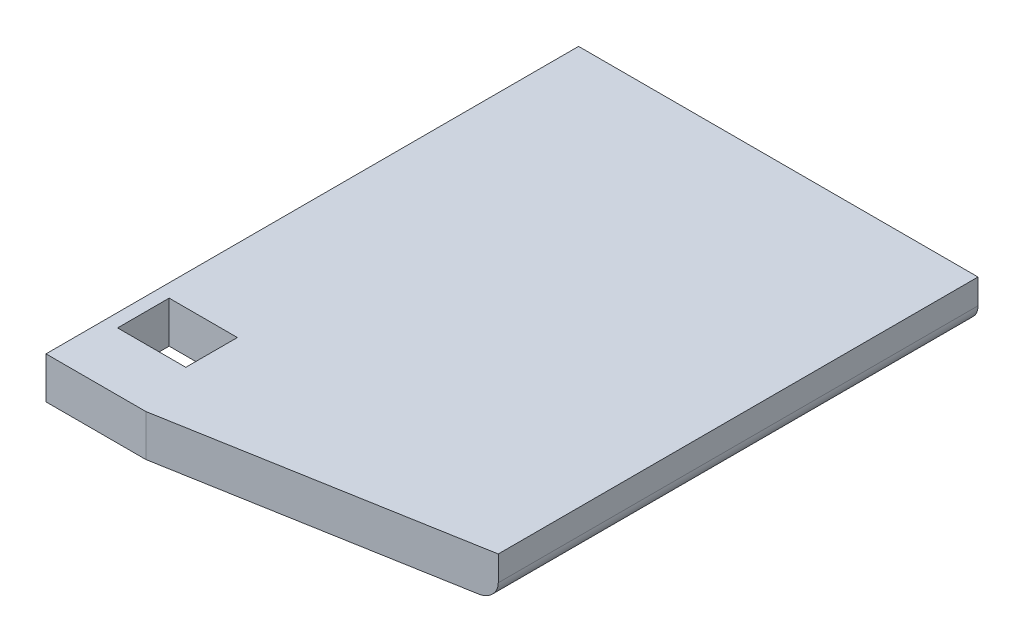
from build123d import *

# Parameters (mm, degrees)
SKETCH_3_W          = 2.5
SKETCH_3_H          = 24
EXTRUDE_1_DEPTH     = 33
FILLET_1_R          = 1
CUT_EXTRUDE_3_DEPTH = 41.880924647
SKETCH_6_W          = 2.5
SKETCH_6_H          = 3.1
CUT_EXTRUDE_4_DEPTH = 4.9
SKETCH_7_W          = 24
SKETCH_7_H          = 2.5
CUT_EXTRUDE_5_DEPTH = 1
CUT_EXTRUDE_6_DEPTH = 41.078048855
CUT_EXTRUDE_7_DEPTH = 1
SKETCH_1927_W       = 0.8
SKETCH_1927_H       = 3.1
EXTRUDE_2_DEPTH     = 2.5


with BuildPart() as part:
    # 草图3 → 凸台-拉伸1 (new body)
    with BuildSketch(Plane(origin=(0, 0, 0), x_dir=(0, 1, 0), z_dir=(0, 0, 1))):
        with Locations((1.25, -12)):
            Rectangle(SKETCH_3_W, SKETCH_3_H)
    extrude(amount=EXTRUDE_1_DEPTH)

    # 圆角1
    fillet_1_edges = [part.edges().sort_by_distance(p)[0] for p in [
        (24, 0, 16.5),
    ]]
    fillet(fillet_1_edges, radius=FILLET_1_R)

    # 草图5 → 切除-拉伸3 (cut, through all)
    with BuildSketch(Plane(origin=(0, 2.5, 0), x_dir=(-1, 0, 0), z_dir=(0, 1, 0))):
        Polygon((-3, 33), (-24, 31.162738066), (-24, 33), align=None)
    extrude(amount=-CUT_EXTRUDE_3_DEPTH, mode=Mode.SUBTRACT)

    # 草图6 → 切除-拉伸4 (cut)
    with BuildSketch(Plane(origin=(0, 0, 0), x_dir=(0, -1, 0), z_dir=(-1, 0, 0))):
        with Locations((-1.25, 26.95)):
            Rectangle(SKETCH_6_W, SKETCH_6_H)
    extrude(amount=-CUT_EXTRUDE_4_DEPTH, mode=Mode.SUBTRACT)

    # 草图7 → 切除-拉伸5 (cut)
    with BuildSketch(Plane.XY.offset(33)):
        with Locations((12, 1.25)):
            Rectangle(SKETCH_7_W, SKETCH_7_H)
    extrude(amount=-CUT_EXTRUDE_5_DEPTH, mode=Mode.SUBTRACT)

    # 草图8 → 切除-拉伸6 (cut, through all)
    with BuildSketch(Plane(origin=(0, 2.5, 0), x_dir=(-1, 0, 0), z_dir=(0, 1, 0))):
        Polygon((-24, 31.162738066), (-24, 28.826114347), (-6, 32), (-14.430052303, 32), align=None)
    extrude(amount=-CUT_EXTRUDE_6_DEPTH, mode=Mode.SUBTRACT)

    # 草图9 → 切除-拉伸7 (cut)
    # profile 1 of 3: a face of its own
    with BuildSketch(Plane.XZ):
        with BuildLine():
            Line((6.826102893, 17.534509717), (7.055889808, 17.586094534))
            Line((7.055889808, 17.586094534), (7.790582664, 16.932686845))
            add(Edge.make_bspline(
                [(7.790582664, 16.932686845), (7.752972061, 16.901011077), (7.686266602, 16.844831529), (7.607093174, 16.776013844), (7.549557385, 16.72407627), (7.505058445, 16.677259698), (7.455177068, 16.620812568), (7.399923749, 16.555326591), (7.342586576, 16.477687324), (7.292080703, 16.382309348), (7.243025403, 16.272950106), (7.216673958, 16.193069549), (7.202828379, 16.1510987)],
                knots=[0, 0, 0, 0, 1.480711259, 2.62616163, 3.15919736, 3.813913131, 4.569696636, 5.427556549, 6.394311754, 7.468779871, 8.670046126, 10, 10, 10, 10], degree=3))
            Line((7.202828379, 16.1510987), (4.998749811, 10.528353586))
            Line((4.998749811, 10.528353586), (4.622024325, 10.517411352))
            Line((4.622024325, 10.517411352), (2.355418705, 16.373069734))
            add(Edge.make_bspline(
                [(2.355418705, 16.373069734), (2.343595726, 16.398160222), (2.317764578, 16.452978568), (2.27196974, 16.540326468), (2.217301146, 16.640414177), (2.155439715, 16.74777141), (2.094310938, 16.855419824), (2.035480198, 16.951053619), (1.98337912, 17.031861495), (1.925224333, 17.11697445), (1.856052924, 17.204012375), (1.795837856, 17.26303752), (1.76766442, 17.290654216)],
                knots=[0, 0, 0, 0, 0.760048084, 1.660572675, 2.702204908, 3.885350124, 5.056107857, 6.094505048, 6.961928109, 7.690750397, 8.919547878, 10, 10, 10, 10], degree=3))
            Line((1.76766442, 17.290654216), (1.620725848, 17.428213729))
            Line((1.620725848, 17.428213729), (1.76766442, 17.554831009))
            Line((1.76766442, 17.554831009), (2.879082762, 17.154657879))
            add(Edge.make_bspline(
                [(2.879082762, 17.154657879), (2.860942204, 17.115124822), (2.827439897, 17.042114467), (2.800294401, 16.926117748), (2.806671207, 16.803059087), (2.836173348, 16.665489098), (2.886974725, 16.509602015), (2.923814048, 16.399607802), (2.94317299, 16.341806208)],
                knots=[0, 0, 0, 0, 0.925705793, 1.709610016, 2.509235913, 3.528169894, 4.701061495, 6, 6, 6, 6], degree=3))
            Line((2.94317299, 16.341806208), (4.811168656, 11.561613114))
            Line((4.811168656, 11.561613114), (6.679164322, 16.373069734))
            add(Edge.make_bspline(
                [(6.679164322, 16.373069734), (6.699826512, 16.433777322), (6.744076006, 16.563786778), (6.785174251, 16.733224985), (6.817366513, 16.871571444), (6.838394784, 16.966283558), (6.853394219, 17.048326943), (6.862581052, 17.098904281), (6.866745477, 17.121831176)],
                knots=[0, 0, 0, 0, 1.493135601, 3.197652068, 4.057375543, 4.802536005, 5.457185135, 6, 6, 6, 6], degree=3))
            add(Edge.make_bspline(
                [(6.866745477, 17.121831176), (6.866172996, 17.163599447), (6.865052356, 17.245361478), (6.852543078, 17.326162831), (6.846424185, 17.365686678)],
                knots=[0, 0, 0, 0, 1.02170334, 2, 2, 2, 2], degree=3))
            Line((6.846424185, 17.365686678), (6.826102893, 17.534509717))
        make_face()
    # profile 2 of 3: a face of its own
    with BuildSketch(Plane.XZ):
        with BuildLine():
            Line((11.364003663, 17.407892437), (11.593790577, 17.407892437))
            Line((11.593790577, 17.407892437), (11.573469286, 11.803905438))
            add(Edge.make_bspline(
                [(11.573469286, 11.803905438), (11.57215625, 11.753352963), (11.56963783, 11.656392655), (11.562088287, 11.517884509), (11.558819088, 11.392199872), (11.551402242, 11.279753622), (11.547137952, 11.180191846), (11.543225715, 11.093592319), (11.53592772, 11.020277115), (11.528248468, 10.904591429), (11.50587219, 10.746228863), (11.471111352, 10.580856867), (11.433173118, 10.466767264), (11.399765074, 10.406001097), (11.350313093, 10.372115518), (11.316404835, 10.377320417), (11.299913435, 10.379851838)],
                knots=[0, 0, 0, 0, 1.394953029, 2.67553809, 3.826273234, 4.862803321, 5.783754953, 6.575504875, 7.253529159, 7.815774618, 9.773449153, 11.659962388, 12.469263007, 13.083324233, 13.554171552, 14, 14, 14, 14], degree=3))
            add(Edge.make_bspline(
                [(11.299913435, 10.379851838), (11.295752273, 10.381432556), (11.278024103, 10.38816703), (11.240968986, 10.399981584), (11.191147952, 10.43568526), (11.166695544, 10.474017809), (11.152974864, 10.495526884)],
                knots=[0, 0, 0, 0, 0.277821374, 1.183627148, 2.41968315, 4, 4, 4, 4], degree=3))
            Line((11.152974864, 10.495526884), (11.048242052, 10.633086397))
            Line((11.048242052, 10.633086397), (10.816891961, 11.012938236))
            add(Edge.make_bspline(
                [(10.816891961, 11.012938236), (10.789247266, 11.048470901), (10.741546866, 11.109781844), (10.687713479, 11.191637945), (10.654166637, 11.24288422), (10.644745807, 11.290357959), (10.687796711, 11.327113841), (10.726162645, 11.387479103), (10.779830154, 11.465076053), (10.828992478, 11.558332765), (10.878147962, 11.656543483), (10.915361738, 11.765135476), (10.942985639, 11.886508306), (10.952140591, 12.003319825), (10.95837894, 12.114916831), (10.960681773, 12.222319127), (10.964822685, 12.349427318), (10.964175917, 12.441155454), (10.963830533, 12.49013983)],
                knots=[0, 0, 0, 0, 1.348621873, 2.327021565, 2.927512079, 3.194695252, 3.6755439, 4.434148094, 5.403918541, 6.472765214, 7.596830534, 8.687787393, 9.903387405, 11.315204673, 12.190562497, 13.252434005, 14.532753282, 16, 16, 16, 16], degree=3))
            Line((10.963830533, 12.49013983), (10.985715001, 16.626304293))
            Line((10.985715001, 16.626304293), (9.89461795, 16.1510987))
            Line((9.89461795, 16.1510987), (9.810206431, 16.330863974))
            add(Edge.make_bspline(
                [(9.810206431, 16.330863974), (9.898046083, 16.376684994), (10.061188901, 16.461787452), (10.282374862, 16.587332688), (10.464901043, 16.693939868), (10.655299483, 16.819162593), (10.867791854, 16.975854409), (11.02849935, 17.107557446), (11.110769104, 17.17497917)],
                knots=[0, 0, 0, 0, 1.147110071, 2.130504433, 2.944870009, 3.594182876, 4.768408533, 6, 6, 6, 6], degree=3))
            Line((11.110769104, 17.17497917), (11.364003663, 17.407892437))
        make_face()
    # profile 3 of 3: a face of its own
    with BuildSketch(Plane.XZ):
        with BuildLine():
            add(Edge.make_bspline(
                [(15.554879296, 14.115843171), (15.564422235, 14.217105414), (15.584047735, 14.425355934), (15.641760216, 14.743418301), (15.724687292, 15.074647026), (15.807897909, 15.358193432), (15.888430624, 15.587171128), (15.963121664, 15.754596989), (16.045187705, 15.917703534), (16.139551959, 16.07386099), (16.24285665, 16.224215684), (16.355587945, 16.368801737), (16.479917756, 16.506649622), (16.612637459, 16.637451594), (16.748797926, 16.75876255), (16.881475213, 16.870855721), (17.011748915, 16.968696708), (17.135676211, 17.057157883), (17.257402755, 17.13082149), (17.374291339, 17.194052923), (17.48822997, 17.244399471), (17.633139291, 17.293153922), (17.807476438, 17.337143979), (18.009450884, 17.375343438), (18.202401522, 17.397217004), (18.327904687, 17.397037479), (18.388917909, 17.396950203)],
                knots=[0, 0, 0, 0, 1.529413248, 3.145309584, 4.856174907, 6.663919439, 7.588678728, 8.50466094, 9.419535901, 10.333571141, 11.246664977, 12.1623118, 13.089194382, 14.0369187, 14.963801283, 15.831851732, 16.648562731, 17.413941845, 18.12099543, 18.787207369, 19.411923779, 19.991920055, 21.085003429, 22.113427482, 23.08284489, 24, 24, 24, 24], degree=3))
            add(Edge.make_bspline(
                [(18.388917909, 17.396950203), (18.446928437, 17.391900877), (18.566996791, 17.381449941), (18.750411797, 17.341113173), (18.944650052, 17.287935187), (19.147949871, 17.219578465), (19.351474125, 17.127556062), (19.546729548, 17.00612579), (19.726248188, 16.852096511), (19.892839753, 16.674852261), (20.04489021, 16.48213183), (20.185161602, 16.284120235), (20.30643579, 16.07979521), (20.415815297, 15.872213943), (20.511092, 15.655861575), (20.589732286, 15.426987731), (20.65795371, 15.18557992), (20.726278727, 14.845990671), (20.789495866, 14.410913695), (20.798143478, 14.058783783), (20.802462101, 13.882929904)],
                knots=[0, 0, 0, 0, 0.666492795, 1.379485695, 2.147045133, 2.973923324, 3.834071854, 4.700351037, 5.598461949, 6.535907071, 7.483128048, 8.408906052, 9.313934277, 10.203092469, 11.095930338, 12.019144949, 12.97363678, 13.967633829, 15.986234022, 18, 18, 18, 18], degree=3))
            add(Edge.make_bspline(
                [(20.802462101, 13.882929904), (20.784072501, 13.741938273), (20.746087558, 13.450710667), (20.666439388, 13.085792449), (20.579282324, 12.784978305), (20.492730615, 12.552195109), (20.38436839, 12.317267356), (20.258203223, 12.080756781), (20.116337354, 11.847811058), (19.955948623, 11.624681404), (19.779188685, 11.413743091), (19.589097773, 11.217247401), (19.390413647, 11.040075586), (19.181498265, 10.895260052), (18.967355817, 10.782386042), (18.749221774, 10.703772974), (18.535520368, 10.650187686), (18.330041745, 10.615646033), (18.135504926, 10.596366358), (18.009096443, 10.600046932), (17.948102196, 10.601822872)],
                knots=[0, 0, 0, 0, 1.601116752, 3.307213304, 4.200501105, 5.127176602, 6.101561659, 7.112436591, 8.145206986, 9.171352057, 10.204622639, 11.242284475, 12.248805296, 13.197957822, 14.098389581, 14.967380699, 15.802967193, 16.576805292, 17.313284303, 18, 18, 18, 18], degree=3))
            add(Edge.make_bspline(
                [(17.948102196, 10.601822872), (17.890125672, 10.605874798), (17.770218621, 10.614254993), (17.585573345, 10.650596106), (17.390717798, 10.705680251), (17.186724086, 10.779664), (16.979577778, 10.878467734), (16.779163628, 11.011493952), (16.585613476, 11.174918393), (16.400018752, 11.365286798), (16.229161831, 11.579599839), (16.073554206, 11.808000525), (15.938171519, 12.050008953), (15.826072871, 12.303061133), (15.733423481, 12.55820433), (15.660180171, 12.808562275), (15.61153227, 13.052425451), (15.584103419, 13.287829108), (15.571907123, 13.512897669), (15.562571761, 13.725518702), (15.555495813, 13.92508861), (15.555079716, 14.0538317), (15.554879296, 14.115843171)],
                knots=[0, 0, 0, 0, 0.738063801, 1.526463623, 2.386101568, 3.310039566, 4.281526039, 5.295424417, 6.357861015, 7.495855073, 8.668693725, 9.836886415, 11.004985247, 12.187747215, 13.350445862, 14.452951707, 15.499752378, 16.506815042, 17.46230185, 18.363824765, 19.211906185, 20, 20, 20, 20], degree=3))
        make_face()
        with BuildLine():
            add(Edge.make_bspline(
                [(16.101990997, 14.093958703), (16.098784775, 14.043433035), (16.091980462, 13.936206379), (16.094074174, 13.765130676), (16.097712456, 13.57483338), (16.110370593, 13.368288247), (16.131486691, 13.150479694), (16.175119371, 12.929315087), (16.23287034, 12.706191262), (16.307430637, 12.483386208), (16.399598142, 12.265119667), (16.504161867, 12.052333507), (16.624997666, 11.849490072), (16.757312493, 11.657207639), (16.900424404, 11.483309741), (17.052000155, 11.33467386), (17.211226318, 11.215540814), (17.375855751, 11.126464922), (17.539858983, 11.06372941), (17.696762644, 11.018075048), (17.845842908, 10.987547111), (17.943280905, 10.983586326), (17.990307955, 10.98167471)],
                knots=[0, 0, 0, 0, 0.752777265, 1.597560053, 2.543382579, 3.583772059, 4.67502432, 5.795284658, 6.932573632, 8.101636569, 9.286241588, 10.454302172, 11.625315944, 12.794866894, 13.923141407, 14.970005954, 15.945004884, 16.870963133, 17.74458397, 18.551546242, 19.300924586, 20, 20, 20, 20], degree=3))
            add(Edge.make_bspline(
                [(17.990307955, 10.98167471), (18.034113238, 10.981902085), (18.126223764, 10.982380191), (18.270447512, 11.000143113), (18.425714381, 11.036346692), (18.592937565, 11.084527258), (18.766703152, 11.157864414), (18.940747275, 11.260775839), (19.113888577, 11.392853829), (19.283820442, 11.549938274), (19.444111143, 11.724593899), (19.589899791, 11.908063191), (19.713369685, 12.099709636), (19.818766336, 12.29774405), (19.906411311, 12.502434534), (19.987167095, 12.709330712), (20.053956919, 12.922227006), (20.111556407, 13.13708239), (20.15707318, 13.351299544), (20.196145881, 13.55895916), (20.220379337, 13.760070452), (20.23675918, 13.957676298), (20.243269982, 14.159596034), (20.237876579, 14.37347289), (20.222394916, 14.602978868), (20.203935872, 14.760981323), (20.194386524, 14.842720146)],
                knots=[0, 0, 0, 0, 0.632667699, 1.330327117, 2.093943891, 2.934871813, 3.842496121, 4.811041161, 5.848627772, 6.983704599, 8.150699218, 9.271399768, 10.365788646, 11.440311158, 12.509120054, 13.581662122, 14.648479966, 15.731542561, 16.794900418, 17.812514597, 18.783806957, 19.720511599, 20.677248084, 21.701526111, 22.810939036, 24, 24, 24, 24], degree=3))
            add(Edge.make_bspline(
                [(20.194386524, 14.842720146), (20.180192278, 14.919514081), (20.152510877, 15.06927643), (20.097033171, 15.283838827), (20.036734414, 15.484243383), (19.965961823, 15.670890817), (19.882060517, 15.848478106), (19.790400265, 16.024642955), (19.676289031, 16.194182959), (19.556409496, 16.363438532), (19.42280207, 16.520333882), (19.276702513, 16.65530095), (19.122375807, 16.769001256), (18.958939173, 16.854055104), (18.797944161, 16.920103026), (18.646076224, 16.970584857), (18.504556115, 17.006149407), (18.412540315, 17.013559534), (18.368596617, 17.017098365)],
                knots=[0, 0, 0, 0, 1.224278867, 2.387569797, 3.473106558, 4.505009639, 5.513980496, 6.552172679, 7.615086431, 8.715042254, 9.804262975, 10.839267005, 11.828086155, 12.800428371, 13.719977161, 14.554574093, 15.309712469, 16, 16, 16, 16], degree=3))
            add(Edge.make_bspline(
                [(18.368596617, 17.017098365), (18.321105753, 17.015380809), (18.22254525, 17.011816266), (18.069986828, 16.988314068), (17.907038377, 16.95199057), (17.731861081, 16.901400194), (17.546019553, 16.823305827), (17.354995251, 16.702043969), (17.157927805, 16.540545686), (16.953389495, 16.345784432), (16.759323685, 16.113728655), (16.589404769, 15.847089084), (16.448704584, 15.549364544), (16.340346265, 15.230403095), (16.251997461, 14.912818606), (16.184724203, 14.614419327), (16.129208801, 14.345586979), (16.110690406, 14.174384633), (16.101990997, 14.093958703)],
                knots=[0, 0, 0, 0, 0.561936315, 1.16621854, 1.822958414, 2.536970437, 3.321485248, 4.199243972, 5.203592191, 6.333015675, 7.53693133, 8.773559575, 10.064280282, 11.423463462, 12.754881785, 13.96339905, 15.043263546, 16, 16, 16, 16], degree=3))
        make_face(mode=Mode.SUBTRACT)
    extrude(amount=-CUT_EXTRUDE_7_DEPTH, mode=Mode.SUBTRACT)

    # Sketch 1927 → 凸台-拉伸2 (add)
    with BuildSketch(Plane.XZ):
        with Locations((0.4, 26.95)):
            Rectangle(SKETCH_1927_W, SKETCH_1927_H)
    extrude(amount=-EXTRUDE_2_DEPTH)


solid = part.part
